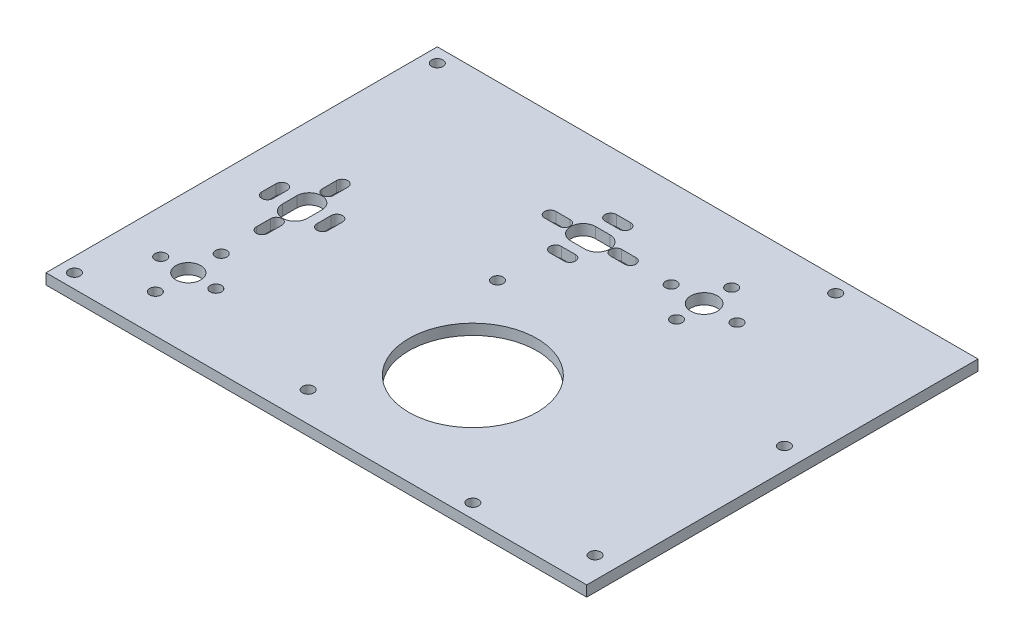
from build123d import *

# Parameters (mm, degrees)
SKETCH1_W           = 120
SKETCH1_H           = 110
BOSS_EXTRUDE1_DEPTH = 3
SKETCH2_R           = 1.6
CUT_EXTRUDE1_DEPTH  = 4
SKETCH3_R           = 18
CUT_EXTRUDE2_DEPTH  = 10
CUT_EXTRUDE3_DEPTH  = 10
SKETCH5_R           = 1.6
CUT_EXTRUDE5_DEPTH  = 10
SKETCH6_R           = 3.5
SKETCH6_R_2         = 3.75
CUT_EXTRUDE6_DEPTH  = 10
SKETCH9_W           = 110
SKETCH9_H           = 3
BOSS_EXTRUDE2_DEPTH = 32
SKETCH8_R           = 1.6
CUT_EXTRUDE8_DEPTH  = 10


with BuildPart() as part:
    # Sketch1 → Boss-Extrude1 (new body)
    with BuildSketch(Plane(origin=(0, 0, 0), x_dir=(1, 0, 0), z_dir=(0, 1, 0))):
        Rectangle(SKETCH1_W, SKETCH1_H)
    extrude(amount=BOSS_EXTRUDE1_DEPTH)

    # Sketch2 → Cut-Extrude1 (cut)
    with BuildSketch(Plane(origin=(0, 3, 0), x_dir=(1, 0, 0), z_dir=(0, 1, 0))):
        with Locations(Location((19.25, 30, 0), (0, 0, 270))):
            Circle(SKETCH2_R)
        with Locations(Location((49.25, 30, 0), (0, 0, 270))):
            Circle(SKETCH2_R)
        with Locations(Location((-40, -14.25, 0), (0, 0, 270))):
            Circle(SKETCH2_R)
        with Locations(Location((-40, -44.25, 0), (0, 0, 270))):
            Circle(SKETCH2_R)
        with Locations(Location((0.75, 30, 0), (0, 0, 270))):
            Circle(SKETCH2_R)
        with Locations(Location((30.75, 30, 0), (0, 0, 270))):
            Circle(SKETCH2_R)
        with Locations(Location((-40, -25.75, 0), (0, 0, 270))):
            Circle(SKETCH2_R)
        with Locations(Location((-40, 4.25, 0), (0, 0, 270))):
            Circle(SKETCH2_R)
        with Locations(Location((-47.75, -5, 0), (0, 0, 270))):
            Circle(SKETCH2_R)
        with Locations(Location((-32.25, -5, 0), (0, 0, 270))):
            Circle(SKETCH2_R)
        with Locations(Location((-47.75, -35, 0), (0, 0, 270))):
            Circle(SKETCH2_R)
        with Locations(Location((-32.25, -35, 0), (0, 0, 270))):
            Circle(SKETCH2_R)
        with Locations(Location((10, 22.25, 0), (0, 0, 270))):
            Circle(SKETCH2_R)
        with Locations(Location((10, 37.75, 0), (0, 0, 270))):
            Circle(SKETCH2_R)
        with Locations(Location((40, 22.25, 0), (0, 0, 270))):
            Circle(SKETCH2_R)
        with Locations(Location((40, 37.75, 0), (0, 0, 270))):
            Circle(SKETCH2_R)
    extrude(amount=-CUT_EXTRUDE1_DEPTH, mode=Mode.SUBTRACT)

    # Sketch3 → Cut-Extrude2 (cut)
    with BuildSketch(Plane(origin=(0, 3, 0), x_dir=(1, 0, 0), z_dir=(0, 1, 0))):
        with Locations(Location((25, -20, 0), (0, 0, 270))):
            Circle(SKETCH3_R)
    extrude(amount=-CUT_EXTRUDE2_DEPTH, mode=Mode.SUBTRACT)

    # Sketch4 → Cut-Extrude3 (cut)
    with BuildSketch(Plane(origin=(0, 3, 0), x_dir=(1, 0, 0), z_dir=(0, 1, 0))):
        with BuildLine():
            Line((-41.6, -14.25), (-41.6, -10.25))
            ThreePointArc((-41.6, -10.25), (-40, -8.65), (-38.4, -10.25))
            Line((-38.4, -10.25), (-38.4, -14.25))
            ThreePointArc((-38.4, -14.25), (-40, -15.85), (-41.6, -14.25))
        make_face()
        with BuildLine():
            Line((-41.6, 4.25), (-41.6, 8.25))
            ThreePointArc((-41.6, 8.25), (-40, 9.85), (-38.4, 8.25))
            Line((-38.4, 8.25), (-38.4, 4.25))
            ThreePointArc((-38.4, 4.25), (-40, 2.65), (-41.6, 4.25))
        make_face()
        with BuildLine():
            Line((19.25, 28.4), (15.25, 28.4))
            ThreePointArc((15.25, 28.4), (13.65, 30), (15.25, 31.6))
            Line((15.25, 31.6), (19.25, 31.6))
            ThreePointArc((19.25, 31.6), (20.85, 30), (19.25, 28.4))
        make_face()
        with BuildLine():
            Line((0.75, 28.4), (-3.25, 28.4))
            ThreePointArc((-3.25, 28.4), (-4.85, 30), (-3.25, 31.6))
            Line((-3.25, 31.6), (0.75, 31.6))
            ThreePointArc((0.75, 31.6), (2.35, 30), (0.75, 28.4))
        make_face()
        with BuildLine():
            Line((-33.85, -5), (-33.85, -1))
            ThreePointArc((-33.85, -1), (-32.25, 0.6), (-30.65, -1))
            Line((-30.65, -1), (-30.65, -5))
            ThreePointArc((-30.65, -5), (-32.25, -6.6), (-33.85, -5))
        make_face()
        with BuildLine():
            Line((-49.35, -5), (-49.35, -1))
            ThreePointArc((-49.35, -1), (-47.75, 0.6), (-46.15, -1))
            Line((-46.15, -1), (-46.15, -5))
            ThreePointArc((-46.15, -5), (-47.75, -6.6), (-49.35, -5))
        make_face()
        with BuildLine():
            Line((10, 20.65), (6, 20.65))
            ThreePointArc((6, 20.65), (4.4, 22.25), (6, 23.85))
            Line((6, 23.85), (10, 23.85))
            ThreePointArc((10, 23.85), (11.6, 22.25), (10, 20.65))
        make_face()
        with BuildLine():
            Line((10, 36.15), (6, 36.15))
            ThreePointArc((6, 36.15), (4.4, 37.75), (6, 39.35))
            Line((6, 39.35), (10, 39.35))
            ThreePointArc((10, 39.35), (11.6, 37.75), (10, 36.15))
        make_face()
    extrude(amount=-CUT_EXTRUDE3_DEPTH, mode=Mode.SUBTRACT)

    # Sketch5 → Cut-Extrude5 (cut)
    with BuildSketch(Plane(origin=(0, 3, 0), x_dir=(1, 0, 0), z_dir=(0, 1, 0))):
        with Locations(Location((-56, 51, 0), (0, 0, 270))):
            Circle(SKETCH5_R)
        with Locations(Location((56, 51, 0), (0, 0, 270))):
            Circle(SKETCH5_R)
        with Locations(Location((56, -51, 0), (0, 0, 270))):
            Circle(SKETCH5_R)
        with Locations(Location((-56, -51, 0), (0, 0, 270))):
            Circle(SKETCH5_R)
    extrude(amount=-CUT_EXTRUDE5_DEPTH, mode=Mode.SUBTRACT)

    # Sketch6 → Cut-Extrude6 (cut)
    with BuildSketch(Plane(origin=(0, 3, 0), x_dir=(1, 0, 0), z_dir=(0, 1, 0))):
        with Locations(Location((-40, -35, 0), (0, 0, 270))):
            Circle(SKETCH6_R)
        with Locations(Location((40, 30, 0), (0, 0, 270))):
            Circle(SKETCH6_R_2)
        with BuildLine():
            Line((-43.5, -5), (-43.5, -1))
            ThreePointArc((-43.5, -1), (-40, 2.5), (-36.5, -1))
            Line((-36.5, -1), (-36.5, -5))
            ThreePointArc((-36.5, -5), (-40, -8.5), (-43.5, -5))
        make_face()
        with BuildLine():
            Line((10, 26.5), (6, 26.5))
            ThreePointArc((6, 26.5), (2.5, 30), (6, 33.5))
            Line((6, 33.5), (10, 33.5))
            ThreePointArc((10, 33.5), (13.5, 30), (10, 26.5))
        make_face()
    extrude(amount=-CUT_EXTRUDE6_DEPTH, mode=Mode.SUBTRACT)

    # Sketch9 → Boss-Extrude2 (add)
    with BuildSketch(Plane(origin=(60, 0, 0), x_dir=(0, 0, -1), z_dir=(1, 0, 0))):
        with Locations((0, 1.5)):
            Rectangle(SKETCH9_W, SKETCH9_H)
    extrude(amount=BOSS_EXTRUDE2_DEPTH)

    # Sketch8 → Cut-Extrude8 (cut)
    with BuildSketch(Plane.XZ):
        with Locations(Location((5.315, -6.608, 0), (0, 0, 270))):
            Circle(SKETCH8_R)
        with Locations(Location((5.315, 46.608, 0), (0, 0, 270))):
            Circle(SKETCH8_R)
        with Locations(Location((85.96, 46.608, 0), (0, 0, 270))):
            Circle(SKETCH8_R)
        with Locations(Location((85.96, -6.608, 0), (0, 0, 270))):
            Circle(SKETCH8_R)
    extrude(amount=-CUT_EXTRUDE8_DEPTH, mode=Mode.SUBTRACT)


solid = part.part
